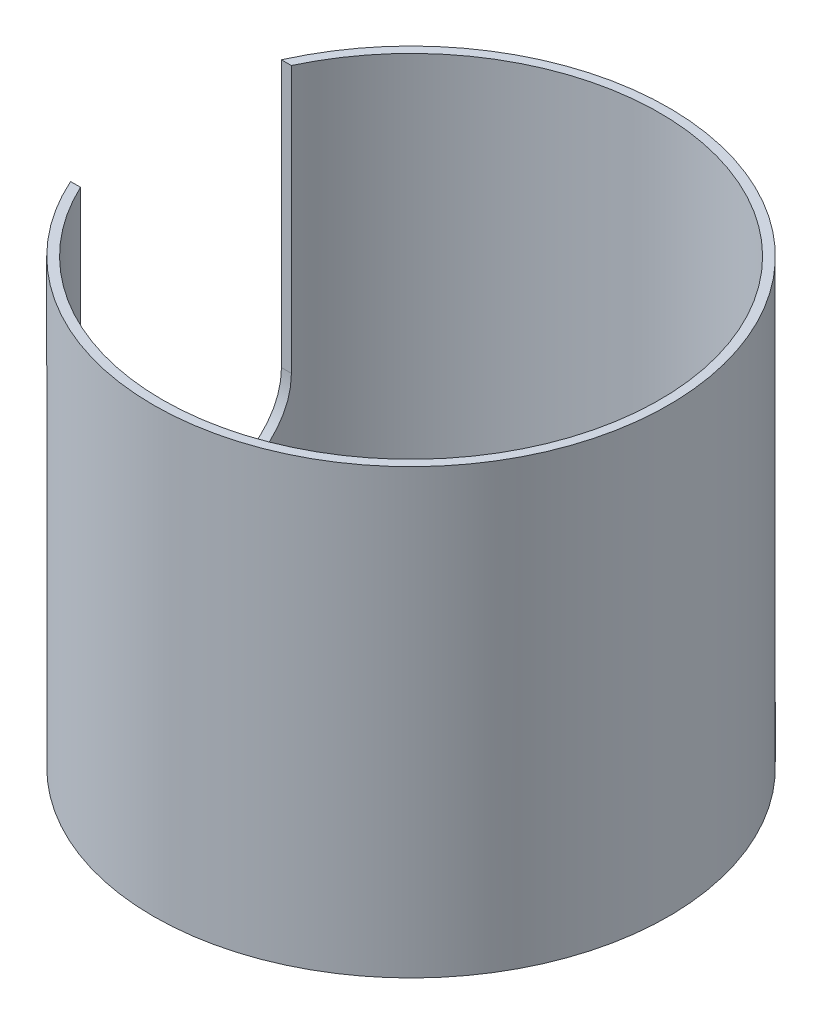
from build123d import *

# Parameters (mm, degrees)
BOSS_EXTRUDE1_DEPTH      = 48
BOSS_EXTRUDE1_DEPTH_BACK = 1
SKETCH1_R                = 28.506
SKETCH1_R_2              = 27.506
CUT_EXTRUDE1_DEPTH       = 48


with BuildPart() as part:
    # Sketch1 → Boss-Extrude1 (new, two sides: drawn at the far end of the back side and taken through both)
    with BuildSketch(Plane(origin=(0, 0, 0), x_dir=(1, 0, 0), z_dir=(0, 1, 0)).offset(-BOSS_EXTRUDE1_DEPTH_BACK)):
        with Locations(Location((0, 0, 0), (0, 0, 270))):
            Circle(SKETCH1_R)
        with Locations(Location((0, 0, 0), (0, 0, 270))):
            Circle(SKETCH1_R_2, mode=Mode.SUBTRACT)
    extrude(amount=BOSS_EXTRUDE1_DEPTH + BOSS_EXTRUDE1_DEPTH_BACK)

    # Sketch2 → Cut-Extrude1 (cut)
    with BuildSketch(Plane(origin=(0, 0, 0), x_dir=(0, 0, -1), z_dir=(1, 0, 0))):
        with BuildLine():
            Line((11.666, 18.5), (11.666, 48))
            Line((11.666, 48), (-11.666, 48))
            Line((-11.666, 48), (-11.666, 18.5))
            ThreePointArc((-11.666, 18.5), (0, 6.834), (11.666, 18.5))
        make_face()
    extrude(amount=-CUT_EXTRUDE1_DEPTH, mode=Mode.SUBTRACT)


solid = part.part
